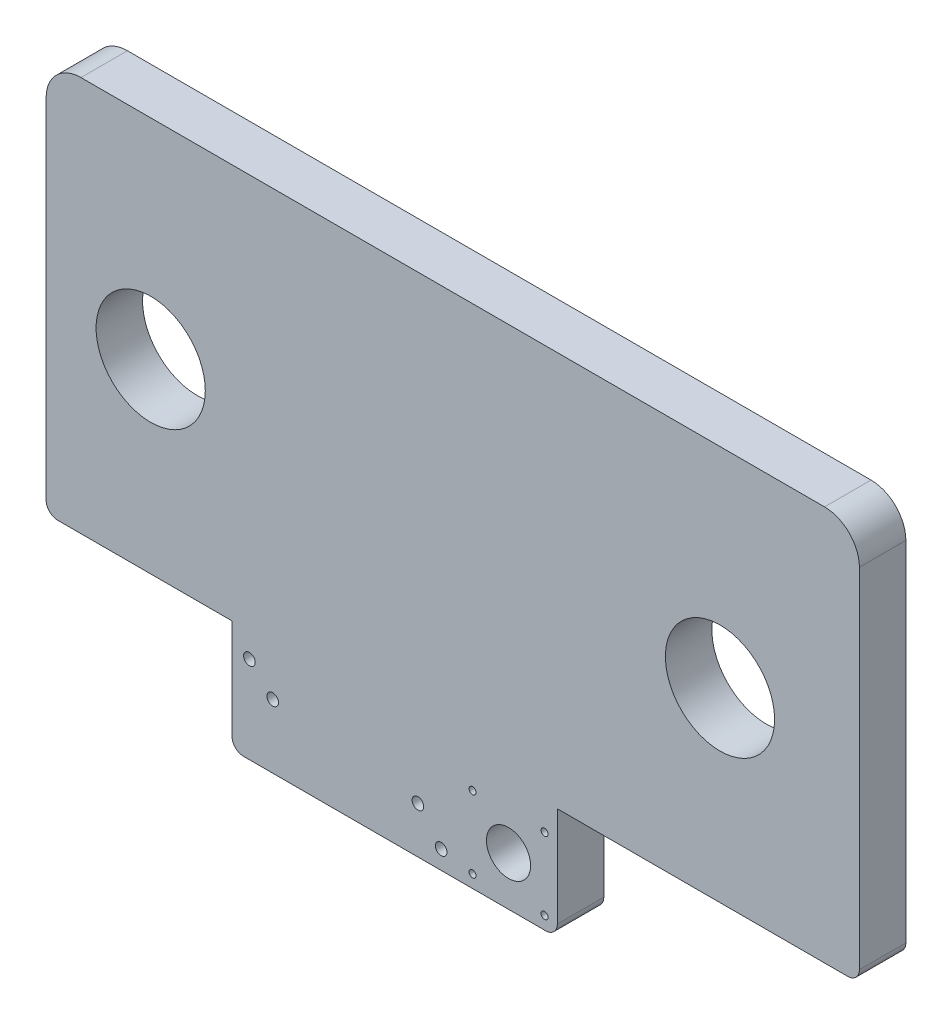
from build123d import *

# Parameters (mm, degrees)
SKETCH_1_R          = 23.5
EXTRUDE_1_DEPTH     = 20
SKETCH_2_R          = 2.5
CUT_EXTRUDE_1_DEPTH = 290.447601331
SKETCH_5_R          = 2.5
CUT_EXTRUDE_3_DEPTH = 290.447601331
SKETCH_6_R          = 9.5
SKETCH_6_R_2        = 1.5
CUT_EXTRUDE_4_DEPTH = 290.447601331
FILLET_1_R          = 5
FILLET_2_R          = 5
FILLET_3_R          = 5
FILLET_4_R          = 5
FILLET_5_R          = 15
FILLET_6_R          = 15


with BuildPart() as part:
    # 草图1 → 凸台-拉伸1 (new body)
    with BuildSketch(Plane.XY):
        Polygon((-112.146066939, 163.723609917), (237.853933061, 163.723609917), (237.853933061, -6.276390083), (107.853933061, -6.276390083), (107.853933061, -54.276390083), (-32.146066939, -54.276390083), (-32.146066939, -6.276390083), (-112.146066939, -6.276390083), align=None)
        with Locations((177.853933061, 73.723609917)):
            Circle(SKETCH_1_R, mode=Mode.SUBTRACT)
        with Locations((-67.146066939, 73.723609917)):
            Circle(SKETCH_1_R, mode=Mode.SUBTRACT)
    extrude(amount=EXTRUDE_1_DEPTH)

    # 草图2 → 切除-拉伸1 (cut, through all)
    with BuildSketch(Plane.XY.offset(20)):
        with Locations((47.853933061, -34.276390083)):
            Circle(SKETCH_2_R)
        with Locations((57.853933061, -46.276390083)):
            Circle(SKETCH_2_R)
    extrude(amount=-CUT_EXTRUDE_1_DEPTH, mode=Mode.SUBTRACT)

    # 草图5 → 切除-拉伸3 (cut, through all)
    with BuildSketch(Plane.XY.offset(20)):
        with Locations((-24.646066939, -16.776390083)):
            Circle(SKETCH_5_R)
        with Locations((-14.646066939, -26.776390083)):
            Circle(SKETCH_5_R)
    extrude(amount=-CUT_EXTRUDE_3_DEPTH, mode=Mode.SUBTRACT)

    # 草图6 → 切除-拉伸4 (cut, through all)
    with BuildSketch(Plane.XY.offset(20)):
        with Locations((86.853933061, -33.276390083)):
            Circle(SKETCH_6_R)
        with Locations((71.353933061, -17.776390083)):
            Circle(SKETCH_6_R_2)
        with Locations(Location((71.353933061, -48.776390083, 0), (0, 0, 180))):
            Circle(SKETCH_6_R_2)
        with Locations((102.353933061, -48.776390083)):
            Circle(SKETCH_6_R_2)
        with Locations(Location((102.353933061, -17.776390083, 0), (0, 0, 180))):
            Circle(SKETCH_6_R_2)
    extrude(amount=-CUT_EXTRUDE_4_DEPTH, mode=Mode.SUBTRACT)

    # 圆角1
    fillet_1_edges = [part.edges().sort_by_distance(p)[0] for p in [
        (-32.146066939, -54.276390083, 10),
    ]]
    fillet(fillet_1_edges, radius=FILLET_1_R)

    # 圆角2
    fillet_2_edges = [part.edges().sort_by_distance(p)[0] for p in [
        (107.853933061, -54.276390083, 10),
    ]]
    fillet(fillet_2_edges, radius=FILLET_2_R)

    # 圆角3
    fillet_3_edges = [part.edges().sort_by_distance(p)[0] for p in [
        (237.853933061, -6.276390083, 10),
    ]]
    fillet(fillet_3_edges, radius=FILLET_3_R)

    # 圆角4
    fillet_4_edges = [part.edges().sort_by_distance(p)[0] for p in [
        (-112.146066939, -6.276390083, 10),
    ]]
    fillet(fillet_4_edges, radius=FILLET_4_R)

    # 圆角5
    fillet_5_edges = [part.edges().sort_by_distance(p)[0] for p in [
        (-112.146066939, 163.723609917, 10),
    ]]
    fillet(fillet_5_edges, radius=FILLET_5_R)

    # 圆角6
    fillet_6_edges = [part.edges().sort_by_distance(p)[0] for p in [
        (237.853933061, 163.723609917, 10),
    ]]
    fillet(fillet_6_edges, radius=FILLET_6_R)


solid = part.part
